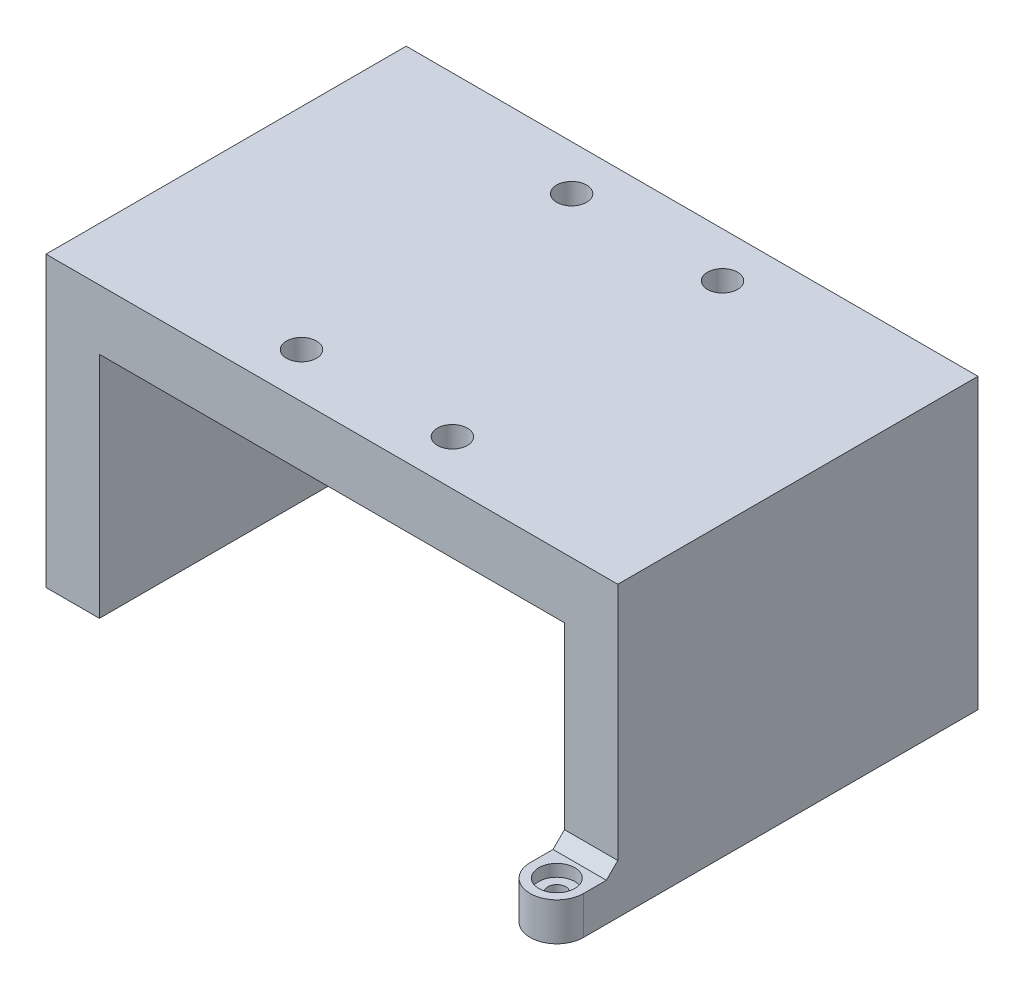
from build123d import *

# Parameters (mm, degrees)
SKETCH2_W           = 95.25
SKETCH2_H           = 60
SKETCH2_R           = 2.5
BOSS_EXTRUDE1_DEPTH = 9.99998
SKETCH4_W           = 8.89
SKETCH4_H           = 60
BOSS_EXTRUDE2_DEPTH = 38.1
SKETCH6_R           = 1.5
SKETCH6_R_2         = 1.500000048
BOSS_EXTRUDE3_DEPTH = 6.35
SKETCH8_R           = 2.99974
CUT_EXTRUDE2_DEPTH  = 1.99898
CHAMFER2_SIZE       = 1.905


with BuildPart() as part:
    # Sketch2 → Boss-Extrude1 (new body)
    with BuildSketch(Plane(origin=(0, 0, 0), x_dir=(1, 0, 0), z_dir=(0, 1, 0))):
        Rectangle(SKETCH2_W, SKETCH2_H)
        with Locations(Location((12.57, 22.5, 0), (0, 0, 270))):
            Circle(SKETCH2_R, mode=Mode.SUBTRACT)
        with Locations(Location((-12.57, 22.5, 0), (0, 0, 270))):
            Circle(SKETCH2_R, mode=Mode.SUBTRACT)
        with Locations(Location((12.57, -22.5, 0), (0, 0, 270))):
            Circle(SKETCH2_R, mode=Mode.SUBTRACT)
        with Locations(Location((-12.57, -22.5, 0), (0, 0, 270))):
            Circle(SKETCH2_R, mode=Mode.SUBTRACT)
    extrude(amount=BOSS_EXTRUDE1_DEPTH)

    # Sketch4 → Boss-Extrude2 (add)
    with BuildSketch(Plane.XZ):
        with Locations((-43.18, 0)):
            Rectangle(SKETCH4_W, SKETCH4_H)
        with Locations((43.18, 0)):
            Rectangle(SKETCH4_W, SKETCH4_H)
    extrude(amount=BOSS_EXTRUDE2_DEPTH)

    # Sketch6 → Boss-Extrude3 (add)
    # profile 1 of 2: a face of its own
    with BuildSketch(Plane.XZ.offset(38.1)):
        with BuildLine():
            Line((-47.625, -4.445), (-53.34, -4.445))
            ThreePointArc((-53.34, -4.445), (-57.785, 0), (-53.34, 4.445))
            Line((-53.34, 4.445), (-47.625, 4.445))
            Line((-47.625, 4.445), (-47.625, -4.445))
        make_face()
        with Locations(Location((-53.34, 0, 0), (0, 0, 270))):
            Circle(SKETCH6_R, mode=Mode.SUBTRACT)
    # profile 2 of 2: a face of its own
    with BuildSketch(Plane.XZ.offset(38.1)):
        with BuildLine():
            Line((38.735, 30), (38.735, 35.715))
            ThreePointArc((38.735, 35.715), (43.18, 40.16), (47.625, 35.715))
            Line((47.625, 35.715), (47.625, 30))
            Line((47.625, 30), (38.735, 30))
        make_face()
        with Locations(Location((43.18, 35.715, 0), (0, 0, 270))):
            Circle(SKETCH6_R_2, mode=Mode.SUBTRACT)
    extrude(amount=-BOSS_EXTRUDE3_DEPTH)

    # Sketch8 → Cut-Extrude2 (cut)
    with BuildSketch(Plane(origin=(0, -31.75, 0), x_dir=(1, 0, 0), z_dir=(0, 1, 0))):
        with Locations(Location((43.18, -35.715, 0), (0, 0, 270))):
            Circle(SKETCH8_R)
        with Locations(Location((-53.34, 0, 0), (0, 0, 270))):
            Circle(SKETCH8_R)
    extrude(amount=-CUT_EXTRUDE2_DEPTH, mode=Mode.SUBTRACT)

    # Chamfer2
    chamfer2_edges = [part.edges().sort_by_distance(p)[0] for p in [
        (-47.625, -31.75, 0),
        (43.18, -31.75, 30),
    ]]
    chamfer(chamfer2_edges, length=CHAMFER2_SIZE)


solid = part.part
